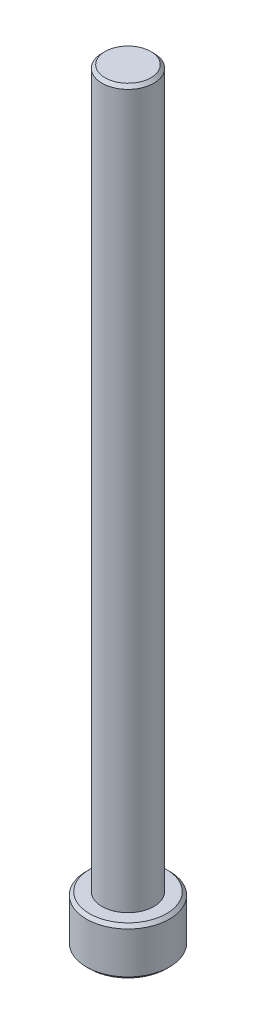
from build123d import *

# Parameters (mm, degrees)
SKETCH1_R           = 4
BOSS_EXTRUDE1_DEPTH = 4.6
SKETCH2_R           = 2.5
BOSS_EXTRUDE2_DEPTH = 69
CHAMFER1_SIZE       = 0.3
CHAMFER2_SIZE       = 0.3


with BuildPart() as part:
    # Sketch1 → Boss-Extrude1 (new body)
    with BuildSketch(Plane(origin=(0, 0, 0), x_dir=(1, 0, 0), z_dir=(0, 1, 0))):
        with Locations(Location((0, 0, 0), (0, 0, 270))):
            Circle(SKETCH1_R)
    extrude(amount=BOSS_EXTRUDE1_DEPTH)

    # Sketch2 → Boss-Extrude2 (add)
    with BuildSketch(Plane(origin=(0, 4.6, 0), x_dir=(1, 0, 0), z_dir=(0, 1, 0))):
        with Locations(Location((0, 0, 0), (0, 0, 270))):
            Circle(SKETCH2_R)
    extrude(amount=BOSS_EXTRUDE2_DEPTH)

    # Chamfer1
    chamfer1_edges = [part.edges().sort_by_distance(p)[0] for p in [
        (0, 0, -4),
        (0, 4.6, -4),
    ]]
    chamfer(chamfer1_edges, length=CHAMFER1_SIZE)

    # Chamfer2
    chamfer2_edges = [part.edges().sort_by_distance(p)[0] for p in [
        (0, 73.6, -2.5),
    ]]
    chamfer(chamfer2_edges, length=CHAMFER2_SIZE)


solid = part.part
